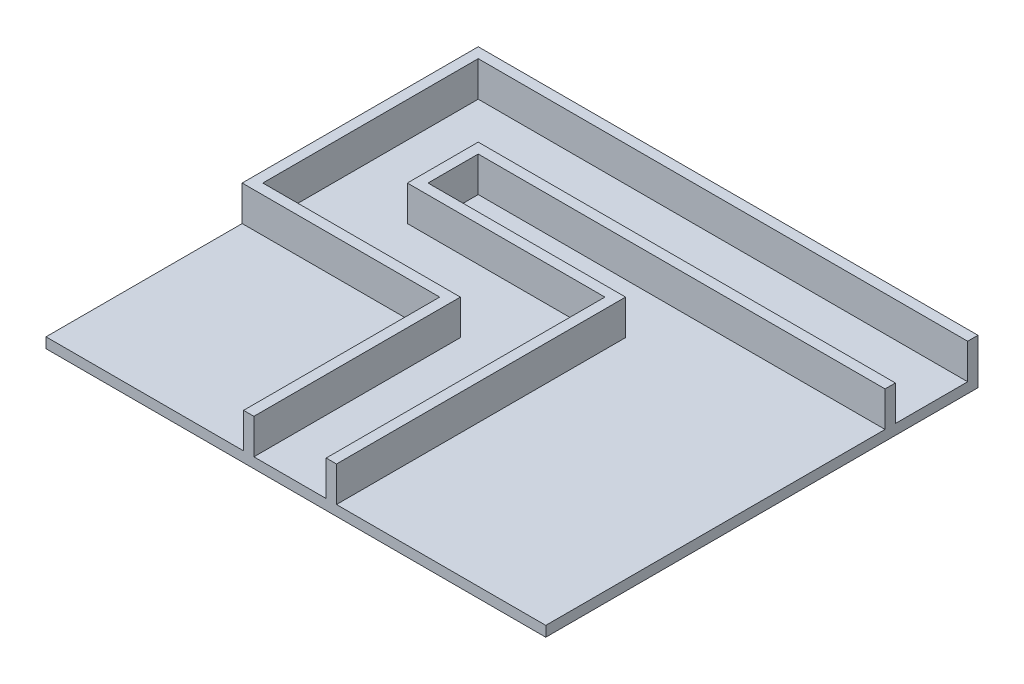
from build123d import *

# Parameters (mm, degrees)
BOSS_EXTRUDE1_DEPTH   = 170
BOSS_EXTRUDE1_2_DEPTH = 170
SKETCH2_W             = 2420.37037037
SKETCH2_H             = 2093.209876543
BOSS_EXTRUDE2_DEPTH   = 50


with BuildPart() as part:
    # Sketch1 → Boss-Extrude1 (new body)
    with BuildSketch(Plane(origin=(0, 0, 0), x_dir=(1, 0, 0), z_dir=(0, 1, 0))):
        Polygon((-257.453122603, -1067.901234568), (-257.453122603, -67.901234568), (-1214.243246059, -67.901234568), (-1214.243246059, 975.308641975), (1156.127124311, 975.308641975), (1156.127124311, 1025.308641975), (-1264.243246059, 1025.308641975), (-1264.243246059, -117.901234568), (-307.453122603, -117.901234568), (-307.453122603, -1067.901234568), align=None)
    extrude(amount=BOSS_EXTRUDE1_DEPTH)



with BuildPart() as body_2:
    # Sketch1 → Boss-Extrude1 2 (new body)
    with BuildSketch(Plane(origin=(0, 0, 0), x_dir=(1, 0, 0), z_dir=(0, 1, 0))):
        Polygon((92.546877397, -1067.901234568), (92.546877397, 282.098765432), (-864.243246059, 282.098765432), (-864.243246059, 625.308641975), (1156.127124311, 625.308641975), (1156.127124311, 575.308641975), (-814.243246059, 575.308641975), (-814.243246059, 332.098765432), (142.546877397, 332.098765432), (142.546877397, -1067.901234568), align=None)
    extrude(amount=BOSS_EXTRUDE1_2_DEPTH)


with BuildPart() as part_1:
    add(part.part)

    add(body_2.part)  # Boss-Extrude2 merges body 2
    # Sketch2 → Boss-Extrude2 (add)
    with BuildSketch(Plane.XZ):
        with Locations((-54.058060874, 21.296296297)):
            Rectangle(SKETCH2_W, SKETCH2_H)
    extrude(amount=BOSS_EXTRUDE2_DEPTH)


solid = part_1.part
